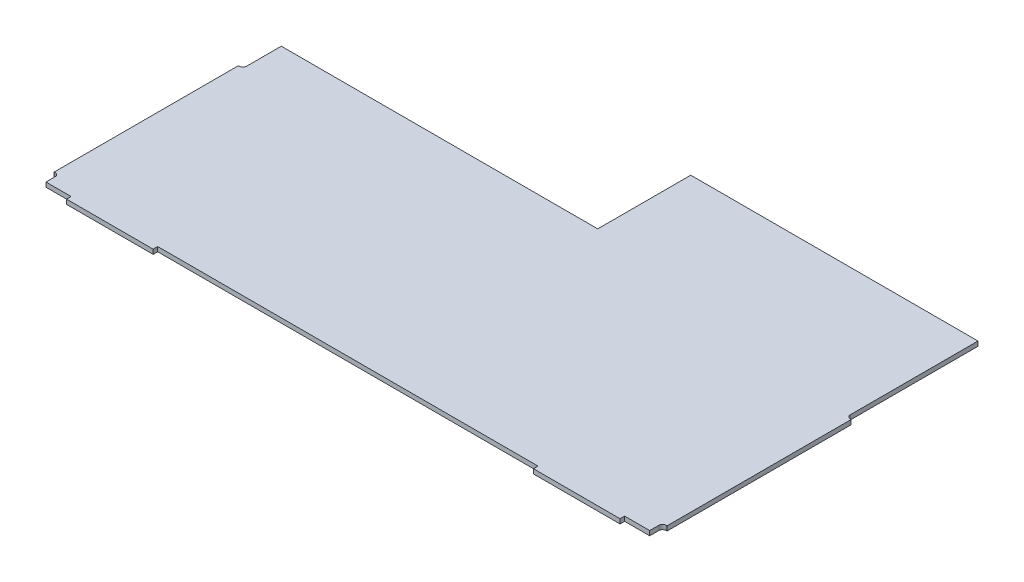
from build123d import *

# Parameters (mm, degrees)
BOSS_EXTRUDE1_DEPTH     = 3.175
CUT_EXTRUDE1_DEPTH      = 285.023893051
CUT_EXTRUDE1_DEPTH_BACK = 285.023893051


with BuildPart() as part:
    # Sketch1 → Boss-Extrude1 (new body)
    with BuildSketch(Plane(origin=(0, 0, 0), x_dir=(1, 0, 0), z_dir=(0, 1, 0))):
        with BuildLine():
            Line((197.005348369, -26.67), (197.005348369, -163.83))
            Line((197.005348369, -163.83), (176.367848369, -163.83))
            Line((176.367848369, -163.83), (176.367848369, -167.005))
            Line((176.367848369, -167.005), (116.042848369, -167.005))
            Line((116.042848369, -167.005), (116.042848369, -163.83))
            Line((116.042848369, -163.83), (-116.042848369, -163.83))
            Line((-116.042848369, -163.83), (-148.752151631, -163.83))
            Line((-148.752151631, -163.83), (-148.752151631, -167.005))
            Line((-148.752151631, -167.005), (-209.077151631, -167.005))
            Line((-209.077151631, -167.005), (-209.077151631, -163.83))
            Line((-209.077151631, -163.83), (-226.539651631, -163.83))
            Line((-226.539651631, -163.83), (-226.539651631, -157.48))
            ThreePointArc((-226.539651631, -157.48), (-227.283600406, -155.683948776), (-229.079651631, -154.94))
            Line((-229.079651631, -154.94), (-229.714651631, -154.94))
            Line((-229.714651631, -154.94), (-229.714651631, -26.67))
            Line((-229.714651631, -26.67), (-229.079651631, -26.67))
            ThreePointArc((-229.079651631, -26.67), (-227.283600406, -25.926051224), (-226.539651631, -24.13))
            Line((-226.539651631, -24.13), (-226.539651631, 0))
            Line((-226.539651631, 0), (-6.194651631, 0))
            Line((-6.194651631, 0), (-6.194651631, 64.77))
            Line((-6.194651631, 64.77), (193.830348369, 64.77))
            Line((193.830348369, 64.77), (193.830348369, -24.13))
            ThreePointArc((193.830348369, -24.13), (194.574297145, -25.926051224), (196.370348369, -26.67))
            Line((196.370348369, -26.67), (197.005348369, -26.67))
        make_face()
    extrude(amount=BOSS_EXTRUDE1_DEPTH)

    # Sketch2 → Cut-Extrude1 (cut, two sides: drawn at the far end of the back side and taken through both)
    with BuildSketch(Plane(origin=(0, 3.175, 0), x_dir=(1, 0, 0), z_dir=(0, 1, 0)).offset(-CUT_EXTRUDE1_DEPTH_BACK)):
        with BuildLine():
            Line((197.005348369, -163.83), (193.830348369, -163.83))
            Line((193.830348369, -163.83), (193.830348369, -157.48))
            ThreePointArc((193.830348369, -157.48), (194.574297145, -155.683948776), (196.370348369, -154.94))
            Line((196.370348369, -154.94), (197.005348369, -154.94))
            Line((197.005348369, -154.94), (197.005348369, -163.83))
        make_face()
    extrude(amount=CUT_EXTRUDE1_DEPTH + CUT_EXTRUDE1_DEPTH_BACK, mode=Mode.SUBTRACT)


solid = part.part
